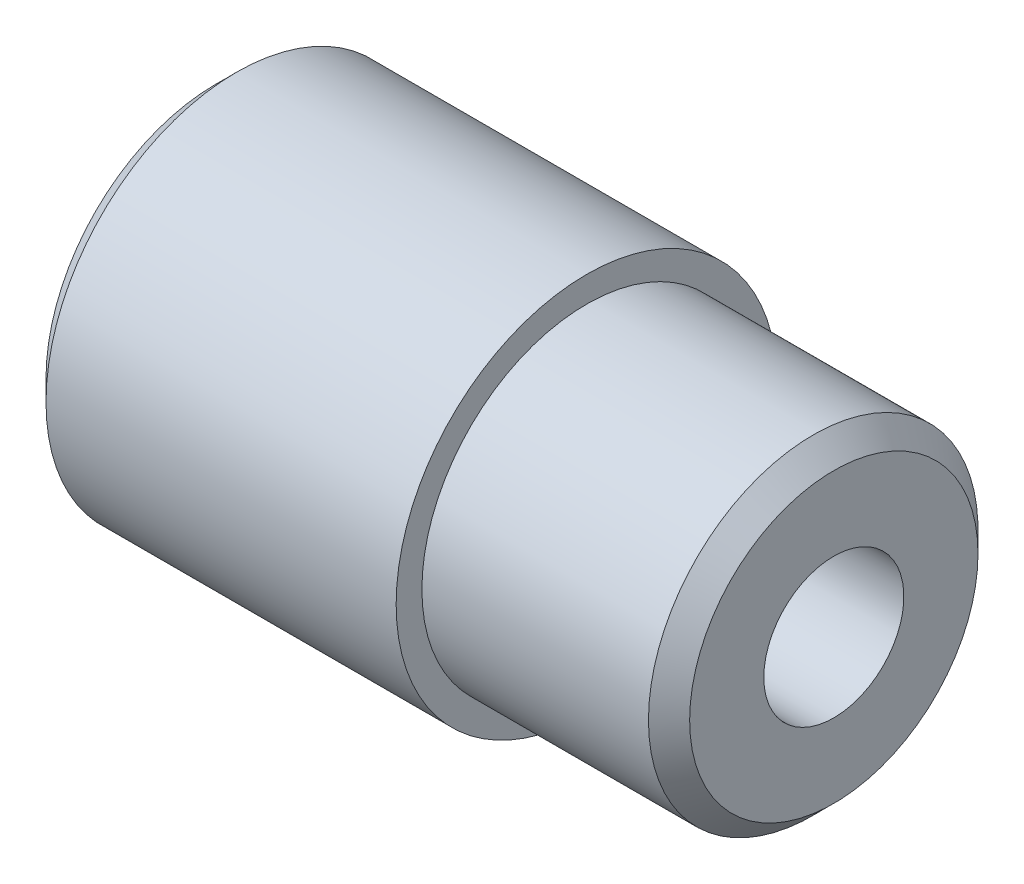
from build123d import *

# Parameters (mm, degrees)
HOLE_WIZARD_M82_D = 6.8
CHAMFER_1_SIZE    = 1


with BuildPart() as part:
    # Эскиз1 → Повернуть1 (revolve)
    with BuildSketch(Plane.XY, mode=Mode.PRIVATE) as revolve_1_sk:
        Polygon((0, 3), (0, 9.25), (18, 9.25), (18, 8), (30, 8), (30, 3), align=None)
    revolve(revolve_1_sk.sketch.rotate(Axis((0, 0, 0), (1, 0, 0)), 90), axis=Axis((0, 0, 0), (1, 0, 0)))

    # Отверстие обработанное метчиком M82 (through all)
    with Locations(Plane.ZY):
        with Locations((0, 0)):
            Hole(HOLE_WIZARD_M82_D / 2)

    # Фаска1
    chamfer_1_edges = [part.edges().sort_by_distance(p)[0] for p in [
        (30, 0, -8),
        (0, 0, -9.25),
    ]]
    chamfer(chamfer_1_edges, length=CHAMFER_1_SIZE)


solid = part.part
